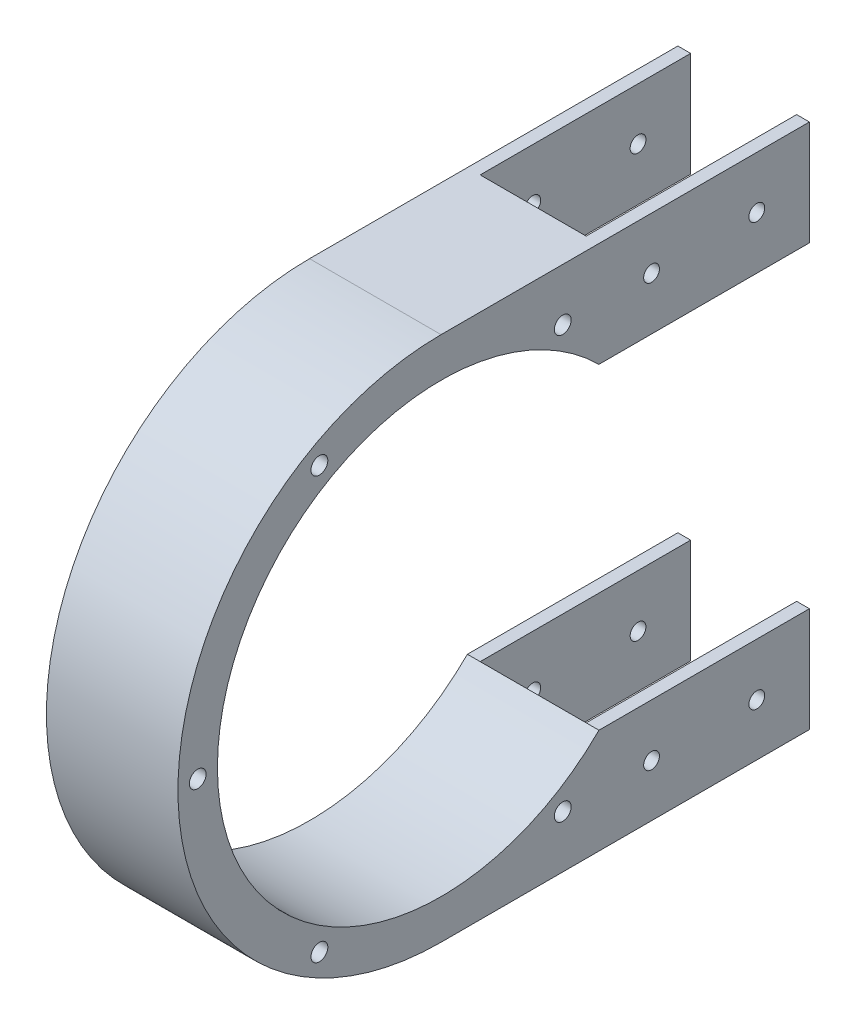
from build123d import *

# Parameters (mm, degrees)
SKETCH_1_R          = 1.6
EXTRUDE_1_DEPTH     = 25
SKETCH_2_W          = 2.43
SKETCH_2_H          = 19.896013553
EXTRUDE_2_DEPTH     = 40
SKETCH_4_R          = 1.5
CUT_EXTRUDE_4_DEPTH = 90.582364336


with BuildPart() as part:
    # 草图1 → 凸台-拉伸1 (new body)
    # profile 1 of 2: a face of its own
    with BuildSketch(Plane(origin=(0, 0, 0), x_dir=(0, 0, -1), z_dir=(1, 0, 0))):
        with BuildLine():
            ThreePointArc((-47.85, 0), (-46.25, 1.6), (-44.65, 0))
            Line((-44.65, 0), (-42.5, 0))
            ThreePointArc((-42.5, 0), (-16.298006013, 39.25079617), (30, 30.103986447))
            Line((30, 30.103986447), (30, 50))
            Line((30, 50), (0, 50))
            ThreePointArc((0, 50), (-35.355339059, 35.355339059), (-50, 0))
            Line((-50, 0), (-47.85, 0))
        make_face()
        with Locations((-23.125, 40.053674925)):
            Circle(SKETCH_1_R, mode=Mode.SUBTRACT)
        with Locations((23.125, 40.053674925)):
            Circle(SKETCH_1_R, mode=Mode.SUBTRACT)
    # profile 2 of 2: a face of its own
    with BuildSketch(Plane(origin=(0, 0, 0), x_dir=(0, 0, -1), z_dir=(1, 0, 0))):
        with BuildLine():
            Line((-42.5, 0), (-44.65, 0))
            ThreePointArc((-44.65, 0), (-46.25, -1.6), (-47.85, 0))
            Line((-47.85, 0), (-50, 0))
            ThreePointArc((-50, 0), (-35.355339059, -35.355339059), (0, -50))
            Line((0, -50), (30, -50))
            Line((30, -50), (30, -30.103986447))
            ThreePointArc((30, -30.103986447), (-16.298006013, -39.25079617), (-42.5, 0))
        make_face()
        with Locations((-23.125, -40.053674925)):
            Circle(SKETCH_1_R, mode=Mode.SUBTRACT)
        with Locations((23.125, -40.053674925)):
            Circle(SKETCH_1_R, mode=Mode.SUBTRACT)
    extrude(amount=EXTRUDE_1_DEPTH)

    # 草图2 → 凸台-拉伸2 (add)
    with BuildSketch(Plane(origin=(0, 0, -30), x_dir=(-1, 0, 0), z_dir=(0, 0, -1))):
        with Locations((-23.785, 40.051993223)):
            Rectangle(SKETCH_2_W, SKETCH_2_H)
        with Locations((-1.215, 40.051993223)):
            Rectangle(SKETCH_2_W, SKETCH_2_H)
        with Locations((-1.215, -40.051993223)):
            Rectangle(SKETCH_2_W, SKETCH_2_H)
        with Locations((-23.785, -40.051993223)):
            Rectangle(SKETCH_2_W, SKETCH_2_H)
    extrude(amount=EXTRUDE_2_DEPTH)

    # 草图4 → 切除-拉伸4 (cut, through all)
    with BuildSketch(Plane(origin=(25, 0, 0), x_dir=(0, 0, -1), z_dir=(1, 0, 0))):
        with Locations((60, -40.103986447)):
            Circle(SKETCH_4_R)
        with Locations((40, -40.103986447)):
            Circle(SKETCH_4_R)
        with Locations(Location((40, 40.103986447, 0), (0, 0, 270))):
            Circle(SKETCH_4_R)
        with Locations(Location((60, 40.103986447, 0), (0, 0, 270))):
            Circle(SKETCH_4_R)
    extrude(amount=-CUT_EXTRUDE_4_DEPTH, mode=Mode.SUBTRACT)


solid = part.part
